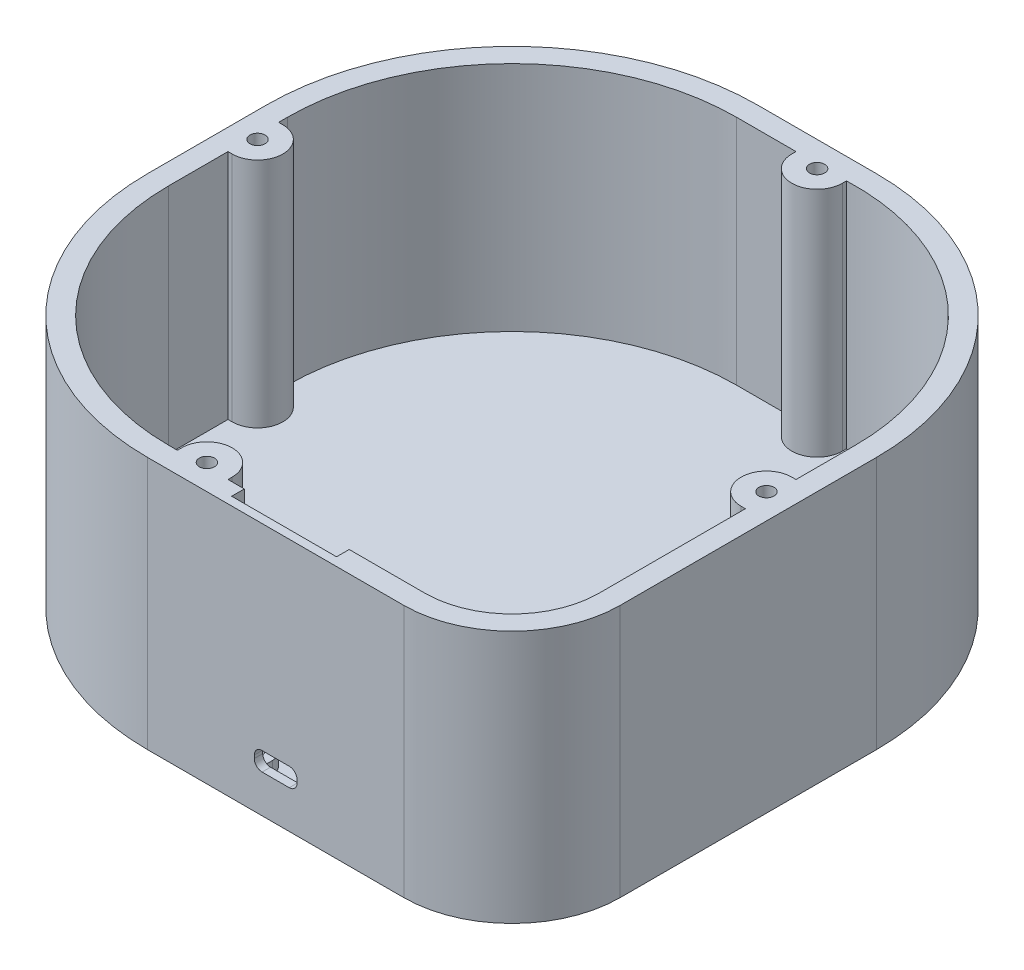
from build123d import *

# Parameters (mm, degrees)
SKETCH1_R           = 3.5
BOSS_EXTRUDE1_DEPTH = 60
BOSS_EXTRUDE2_DEPTH = 5
BOSS_EXTRUDE3_START = 5
SKETCH1_4_R         = 1.25
SKETCH1_4_R_2       = 2.143
BOSS_EXTRUDE3_DEPTH = 3
CUT_EXTRUDE1_REACH  = 213.819
BOSS_EXTRUDE4_START = 57
SKETCH1_6_R         = 3.5
SKETCH1_6_R_2       = 1.8
BOSS_EXTRUDE4_DEPTH = 3


with BuildPart() as part:
    # Sketch1 → Boss-Extrude1 (new body)
    with BuildSketch(Plane(origin=(0, 0, 0), x_dir=(1, 0, 0), z_dir=(0, 1, 0))):
        with BuildLine():
            ThreePointArc((0, 58.25), (17.061029996, 17.061029996), (58.25, 0))
            Line((58.25, 0), (118.99047, 0))
            ThreePointArc((118.99047, 0), (137.127758937, 7.512711063), (144.64047, 25.65))
            Line((144.64047, 25.65), (144.64047, 86.39047))
            ThreePointArc((144.64047, 86.39047), (127.579440004, 127.579440004), (86.39047, 144.64047))
            Line((86.39047, 144.64047), (58.25, 144.64047))
            ThreePointArc((58.25, 144.64047), (17.061029996, 127.579440004), (0, 86.39047))
            Line((0, 86.39047), (0, 58.25))
        make_face()
        with Locations(Location((66.320235, 6, 0), (0, 0, 270))):
            Circle(SKETCH1_R, mode=Mode.SUBTRACT)
        with BuildLine():
            ThreePointArc((5, 86.39047), (20.596563902, 124.043906098), (58.25, 139.64047))
            Line((58.25, 139.64047), (72.320235, 139.64047))
            Line((72.320235, 139.64047), (72.320235, 138.64047))
            ThreePointArc((72.320235, 138.64047), (78.320235, 132.64047), (84.320235, 138.64047))
            Line((84.320235, 138.64047), (84.320235, 139.600211843))
            ThreePointArc((84.320235, 139.600211843), (123.304711738, 124.768865705), (139.64047, 86.39047))
            Line((139.64047, 86.39047), (139.64047, 72.320235))
            Line((139.64047, 72.320235), (138.64047, 72.320235))
            ThreePointArc((138.64047, 72.320235), (132.64047, 66.320235), (138.64047, 60.320235))
            Line((138.64047, 60.320235), (139.64047, 60.320235))
            Line((139.64047, 60.320235), (139.64047, 25.65))
            ThreePointArc((139.64047, 25.65), (133.592225032, 11.048244968), (118.99047, 5))
            Line((118.99047, 5), (101.050235, 5))
            Line((101.050235, 5), (101.050235, 4.54))
            Line((101.050235, 4.54), (101.050235, 2))
            Line((101.050235, 2), (100.050235, 2))
            Line((100.050235, 2), (93.970235, 2))
            Line((93.970235, 2), (83.270235, 2))
            Line((83.270235, 2), (77.190235, 2))
            Line((77.190235, 2), (76.190235, 2))
            Line((76.190235, 2), (76.190235, 4.54))
            Line((76.190235, 4.54), (76.190235, 5))
            Line((76.190235, 5), (72.320235, 5))
            Line((72.320235, 5), (72.320235, 6))
            ThreePointArc((72.320235, 6), (66.320235, 12), (60.320235, 6))
            Line((60.320235, 6), (60.320235, 5))
            Line((60.320235, 5), (58.25, 5))
            ThreePointArc((58.25, 5), (20.596563902, 20.596563902), (5, 58.25))
            Line((5, 58.25), (5, 72.320235))
            Line((5, 72.320235), (6, 72.320235))
            ThreePointArc((6, 72.320235), (12, 78.320235), (6, 84.320235))
            Line((6, 84.320235), (5, 84.320235))
            Line((5, 84.320235), (5, 86.39047))
        make_face(mode=Mode.SUBTRACT)
        with Locations(Location((138.64047, 66.320235, 0), (0, 0, 270))):
            Circle(SKETCH1_R, mode=Mode.SUBTRACT)
        with Locations(Location((6, 78.320235, 0), (0, 0, 270))):
            Circle(SKETCH1_R, mode=Mode.SUBTRACT)
        with Locations(Location((78.320235, 138.64047, 0), (0, 0, 270))):
            Circle(SKETCH1_R, mode=Mode.SUBTRACT)
    extrude(amount=BOSS_EXTRUDE1_DEPTH)

    # Sketch1<2> → Boss-Extrude2 (add)
    with BuildSketch(Plane(origin=(0, 0, 0), x_dir=(1, 0, 0), z_dir=(0, 1, 0))):
        with BuildLine():
            Line((72.320235, 139.64047), (58.25, 139.64047))
            ThreePointArc((58.25, 139.64047), (20.596563902, 124.043906098), (5, 86.39047))
            Line((5, 86.39047), (5, 84.320235))
            Line((5, 84.320235), (6, 84.320235))
            ThreePointArc((6, 84.320235), (12, 78.320235), (6, 72.320235))
            Line((6, 72.320235), (5, 72.320235))
            Line((5, 72.320235), (5, 58.25))
            ThreePointArc((5, 58.25), (20.596563902, 20.596563902), (58.25, 5))
            Line((58.25, 5), (60.320235, 5))
            Line((60.320235, 5), (60.320235, 6))
            ThreePointArc((60.320235, 6), (66.320235, 12), (72.320235, 6))
            Line((72.320235, 6), (72.320235, 5))
            Line((72.320235, 5), (76.190235, 5))
            Line((76.190235, 5), (76.190235, 2))
            Line((76.190235, 2), (101.050235, 2))
            Line((101.050235, 2), (101.050235, 5))
            Line((101.050235, 5), (118.99047, 5))
            ThreePointArc((118.99047, 5), (133.592225032, 11.048244968), (139.64047, 25.65))
            Line((139.64047, 25.65), (139.64047, 60.320235))
            Line((139.64047, 60.320235), (138.64047, 60.320235))
            ThreePointArc((138.64047, 60.320235), (132.64047, 66.320235), (138.64047, 72.320235))
            Line((138.64047, 72.320235), (139.64047, 72.320235))
            Line((139.64047, 72.320235), (139.64047, 86.39047))
            ThreePointArc((139.64047, 86.39047), (123.304711738, 124.768865705), (84.320235, 139.600211843))
            Line((84.320235, 139.600211843), (84.320235, 138.64047))
            ThreePointArc((84.320235, 138.64047), (78.320235, 132.64047), (72.320235, 138.64047))
            Line((72.320235, 138.64047), (72.320235, 139.64047))
        make_face()
    extrude(amount=BOSS_EXTRUDE2_DEPTH)

    # Sketch1<4> → Boss-Extrude3 (add)
    # profile 1 of 4: a face of its own
    with BuildSketch(Plane(origin=(0, 0, 0), x_dir=(1, 0, 0), z_dir=(0, 1, 0)).offset(BOSS_EXTRUDE3_START)):
        with BuildLine():
            Line((101.050235, 2), (101.050235, 4.54))
            ThreePointArc((101.050235, 4.54), (97.510235, 8.08), (93.970235, 4.54))
            Line((93.970235, 4.54), (93.970235, 2))
            Line((93.970235, 2), (101.050235, 2))
        make_face()
        with Locations(Location((97.510235, 4.54, 0), (0, 0, 270))):
            Circle(SKETCH1_4_R, mode=Mode.SUBTRACT)
    # profile 2 of 4: a face of its own
    with BuildSketch(Plane(origin=(0, 0, 0), x_dir=(1, 0, 0), z_dir=(0, 1, 0)).offset(BOSS_EXTRUDE3_START)):
        with BuildLine():
            ThreePointArc((83.270235, 4.54), (79.730235, 8.08), (76.190235, 4.54))
            Line((76.190235, 4.54), (76.190235, 2))
            Line((76.190235, 2), (83.270235, 2))
            Line((83.270235, 2), (83.270235, 4.54))
        make_face()
        with Locations(Location((79.730235, 4.54, 0), (0, 0, 270))):
            Circle(SKETCH1_4_R, mode=Mode.SUBTRACT)
    # profile 3 of 4: a face of its own
    with BuildSketch(Plane(origin=(0, 0, 0), x_dir=(1, 0, 0), z_dir=(0, 1, 0)).offset(BOSS_EXTRUDE3_START)):
        with Locations(Location((79.730235, 50.26, 0), (0, 0, 270))):
            Circle(SKETCH1_4_R_2)
    # profile 4 of 4: a face of its own
    with BuildSketch(Plane(origin=(0, 0, 0), x_dir=(1, 0, 0), z_dir=(0, 1, 0)).offset(BOSS_EXTRUDE3_START)):
        with Locations(Location((97.510235, 50.26, 0), (0, 0, 270))):
            Circle(SKETCH1_4_R_2)
    extrude(amount=BOSS_EXTRUDE3_DEPTH)

    # Sketch2 → Cut-Extrude1 (cut, up to next)
    with BuildSketch(Plane(origin=(0, 0, -2), x_dir=(-1, 0, 0), z_dir=(0, 0, -1)), mode=Mode.PRIVATE) as cut_extrude1_sk1:
        with BuildLine():
            Line((-91.840235, 13.4), (-85.400235, 13.4))
            ThreePointArc((-85.400235, 13.4), (-84.092087455, 12.858147545), (-83.550235, 11.55))
            Line((-83.550235, 11.55), (-83.550235, 10.84))
            ThreePointArc((-83.550235, 10.84), (-84.092087455, 9.531852455), (-85.400235, 8.99))
            Line((-85.400235, 8.99), (-91.840235, 8.99))
            ThreePointArc((-91.840235, 8.99), (-93.148382545, 9.531852455), (-93.690235, 10.84))
            Line((-93.690235, 10.84), (-93.690235, 11.55))
            ThreePointArc((-93.690235, 11.55), (-93.148382545, 12.858147545), (-91.840235, 13.4))
        make_face()
    cut_extrude1_tool1 = extrude(cut_extrude1_sk1.sketch, amount=-CUT_EXTRUDE1_REACH, mode=Mode.PRIVATE) & part.part
    add(cut_extrude1_tool1.solids().sort_by_distance((88.620235, 11.195, -2))[0], mode=Mode.SUBTRACT)

    # Sketch1<6> → Boss-Extrude4 (add)
    # profile 1 of 4: a face of its own
    with BuildSketch(Plane(origin=(0, 0, 0), x_dir=(1, 0, 0), z_dir=(0, 1, 0)).offset(BOSS_EXTRUDE4_START)):
        with Locations(Location((6, 78.320235, 0), (0, 0, 270))):
            Circle(SKETCH1_6_R)
        with Locations(Location((6, 78.320235, 0), (0, 0, 270))):
            Circle(SKETCH1_6_R_2, mode=Mode.SUBTRACT)
    # profile 2 of 4: a face of its own
    with BuildSketch(Plane(origin=(0, 0, 0), x_dir=(1, 0, 0), z_dir=(0, 1, 0)).offset(BOSS_EXTRUDE4_START)):
        with Locations(Location((78.320235, 138.64047, 0), (0, 0, 270))):
            Circle(SKETCH1_6_R)
        with Locations(Location((78.320235, 138.64047, 0), (0, 0, 270))):
            Circle(SKETCH1_6_R_2, mode=Mode.SUBTRACT)
    # profile 3 of 4: a face of its own
    with BuildSketch(Plane(origin=(0, 0, 0), x_dir=(1, 0, 0), z_dir=(0, 1, 0)).offset(BOSS_EXTRUDE4_START)):
        with Locations(Location((138.64047, 66.320235, 0), (0, 0, 270))):
            Circle(SKETCH1_6_R)
        with Locations(Location((138.64047, 66.320235, 0), (0, 0, 270))):
            Circle(SKETCH1_6_R_2, mode=Mode.SUBTRACT)
    # profile 4 of 4: a face of its own
    with BuildSketch(Plane(origin=(0, 0, 0), x_dir=(1, 0, 0), z_dir=(0, 1, 0)).offset(BOSS_EXTRUDE4_START)):
        with Locations(Location((66.320235, 6, 0), (0, 0, 270))):
            Circle(SKETCH1_6_R)
        with Locations(Location((66.320235, 6, 0), (0, 0, 270))):
            Circle(SKETCH1_6_R_2, mode=Mode.SUBTRACT)
    extrude(amount=BOSS_EXTRUDE4_DEPTH)


solid = part.part
